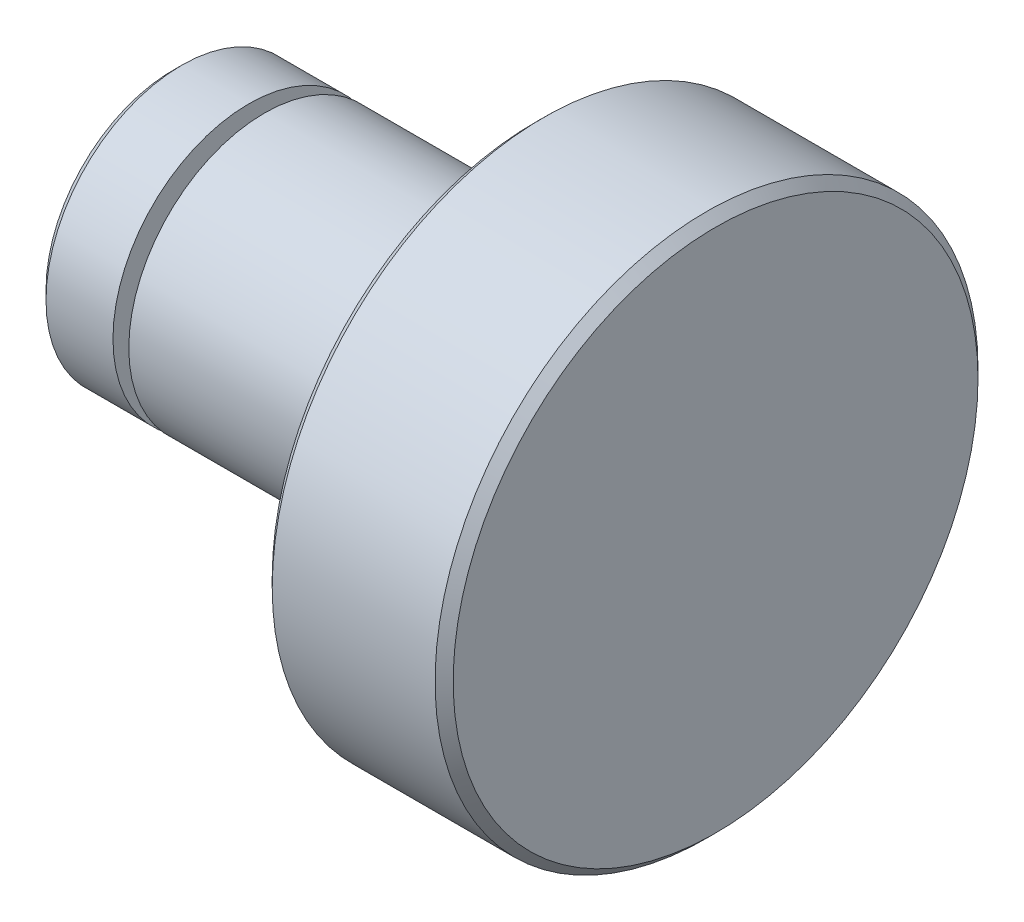
from build123d import *

# Parameters (mm, degrees)
SMUSSO1_SIZE = 1
SCHIZZO2_W   = 1.6
SCHIZZO2_H   = 3
SCHIZZO2_W_2 = 0.15


with BuildPart() as part:
    # Schizzo1 → Rivoluzione1 (revolve)
    with BuildSketch(Plane.XY, mode=Mode.PRIVATE) as rivoluzione1_sk:
        Polygon((0, 0), (0, 30), (-20, 30), (-20, 15), (-60, 15), (-60, 0), align=None)
    revolve(rivoluzione1_sk.sketch.rotate(Axis((0, 0, 0), (-1, 0, 0)), 90), axis=Axis((0, 0, 0), (-1, 0, 0)))

    # Smusso1
    smusso1_edges = [part.edges().sort_by_distance(p)[0] for p in [
        (-60, 0, 15),
        (-20, 0, 30),
        (0, 0, 30),
    ]]
    chamfer(smusso1_edges, length=SMUSSO1_SIZE)

    # Schizzo2 → Taglia-Rivoluzione1 (revolve, cut)
    with BuildSketch(Plane.XY, mode=Mode.PRIVATE) as taglia_rivoluzione1_sk:
        with Locations((-50.8, 13.5)):
            Rectangle(SCHIZZO2_W, SCHIZZO2_H)
        with Locations((-49.925, 13.5)):
            Rectangle(SCHIZZO2_W_2, SCHIZZO2_H)
    revolve(taglia_rivoluzione1_sk.sketch.rotate(Axis((0, 0, 0), (-1, 0, 0)), 90), axis=Axis((0, 0, 0), (-1, 0, 0)), mode=Mode.SUBTRACT)


solid = part.part
